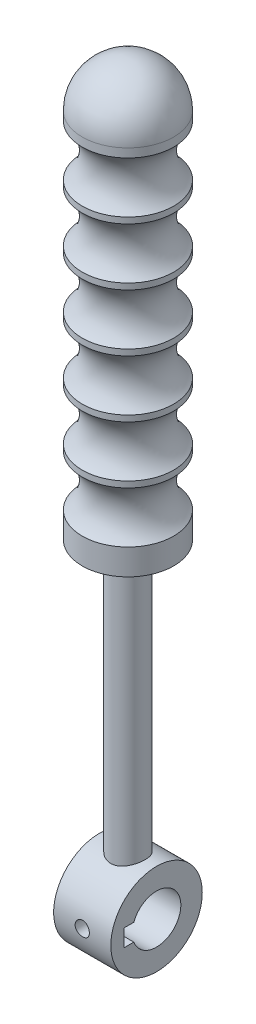
from build123d import *

# Parameters (mm, degrees)
SKETCH1_R                    = 8
SHAFT_BOSS_DEPTH             = 5
SKETCH2_R                    = 3
BOSS_EXTRUDE2_DEPTH          = 120
F_8_0_8_DIAMETER_HOLE1_D     = 8.5
F_8_0_8_DIAMETER_HOLE1_DEPTH = 12.7
F_8_0_8_DIAMETER_HOLE1_TIP   = 2.553657631
SKETCH6_W                    = 3
SKETCH6_H                    = 3
CUT_KEYWAY_3X3_DEPTH         = 129.906943186
SKETCH9_W                    = 1.25
SKETCH9_H                    = 8
SKETCH7_R                    = 6
LPATTERN1_COUNT              = 6
LPATTERN1_PITCH              = 10


with BuildPart() as part:
    # Sketch1 → Shaft-Boss (new, symmetric)
    with BuildSketch(Plane(origin=(0, 0, 0), x_dir=(0, 0, -1), z_dir=(1, 0, 0))):
        Circle(SKETCH1_R)
    extrude(amount=SHAFT_BOSS_DEPTH, both=True)

    # Sketch2 → Boss-Extrude2 (add)
    with BuildSketch(Plane(origin=(0, 0, 0), x_dir=(1, 0, 0), z_dir=(0, 1, 0))):
        with Locations(Location((0, 0, 0), (0, 0, 90))):
            Circle(SKETCH2_R)
    extrude(amount=BOSS_EXTRUDE2_DEPTH)

    # Sketch3 → Handle-Revolve (revolve)
    with BuildSketch(Plane(origin=(0, 0, 0), x_dir=(0, 0, -1), z_dir=(1, 0, 0)), mode=Mode.PRIVATE) as handle_revolve_sk:
        with BuildLine():
            Line((0, 128), (0, 55))
            Line((0, 55), (-8, 55))
            Line((-8, 55), (-8, 120))
            ThreePointArc((-8, 120), (-5.656854249, 125.656854249), (0, 128))
        make_face()
    revolve(handle_revolve_sk.sketch.rotate(Axis((0, 128, 0), (0, -1, 0)), 180), axis=Axis((0, 128, 0), (0, -1, 0)))

    # Ø8.0 (8) Diameter Hole1
    with Locations(Plane(origin=(5, 0, 0), x_dir=(0, 0, -1), z_dir=(1, 0, 0))):
        with Locations((0, 0)):
            Hole(F_8_0_8_DIAMETER_HOLE1_D / 2, depth=F_8_0_8_DIAMETER_HOLE1_DEPTH)
            with Locations((0, 0, -(F_8_0_8_DIAMETER_HOLE1_DEPTH + F_8_0_8_DIAMETER_HOLE1_TIP / 2))):  # 118° drill point
                Cone(0, F_8_0_8_DIAMETER_HOLE1_D / 2, F_8_0_8_DIAMETER_HOLE1_TIP, mode=Mode.SUBTRACT)

    # Sketch6 → Cut-Keyway 3x3 (cut, through all)
    with BuildSketch(Plane(origin=(5, 0, 0), x_dir=(0, 0, -1), z_dir=(1, 0, 0))):
        with Locations((-4.15, 0)):
            Rectangle(SKETCH6_W, SKETCH6_H)
    extrude(amount=-CUT_KEYWAY_3X3_DEPTH, mode=Mode.SUBTRACT)

    # Sketch9 → M3x0.5 Tapped Hole1 (revolve, cut)
    with BuildSketch(Plane.YZ):
        with Locations((0.625, 4)):
            Rectangle(SKETCH9_W, SKETCH9_H)
    revolve(axis=Axis((0, 0, -6.35), (0, 0, 1)), mode=Mode.SUBTRACT)

    # Sketch7 → Cut-Revolve1 (revolve, cut)
    with BuildSketch(Plane(origin=(0, 0, 0), x_dir=(0, 0, -1), z_dir=(1, 0, 0))):
        with Locations((-12, 114)):
            Circle(SKETCH7_R)
    cut_revolve1 = revolve(axis=Axis((0, 132.7, 0), (0, -1, 0)), mode=Mode.SUBTRACT)

    # LPattern1: Cut-Revolve1 ×6
    with Locations(*[(0, -i * LPATTERN1_PITCH, 0) for i in range(1, LPATTERN1_COUNT)]):
        add(cut_revolve1, mode=Mode.SUBTRACT)


solid = part.part
